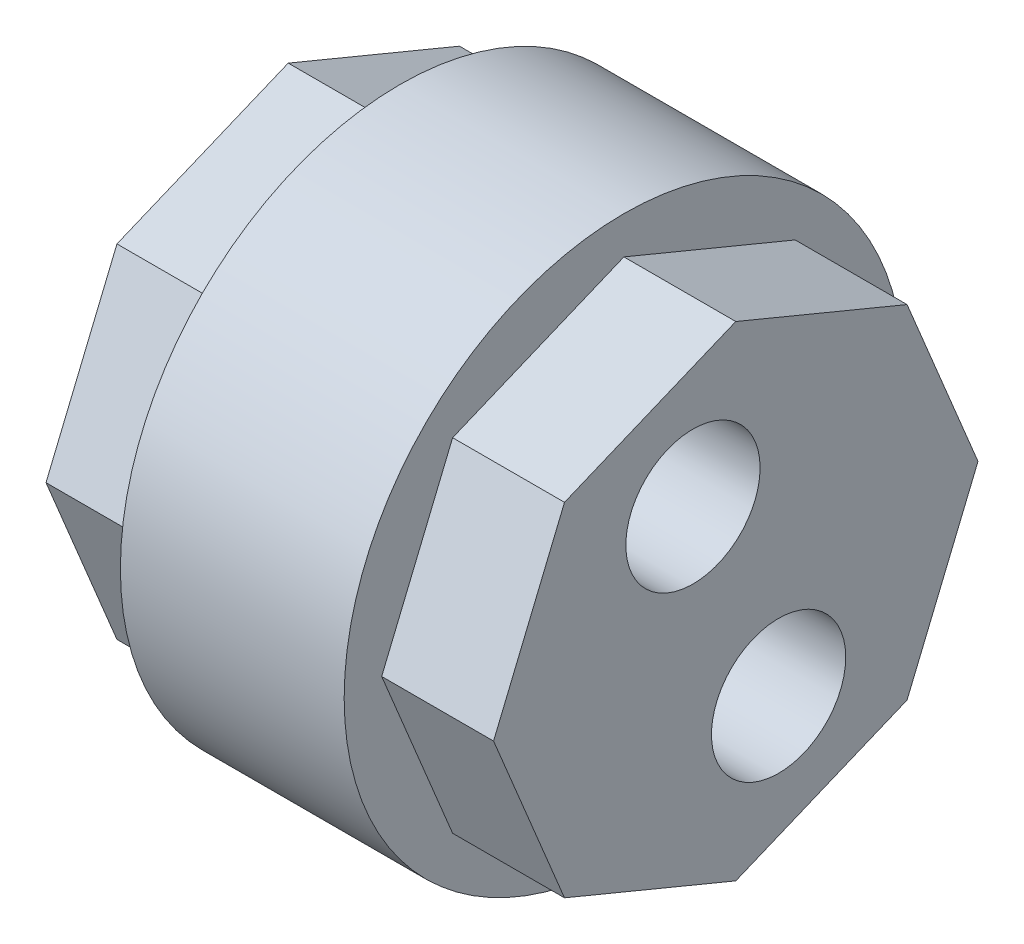
from build123d import *

# Parameters (mm, degrees)
SKETCH2_R                = 12.5
BOSS_EXTRUDE1_DEPTH      = 10
BOSS_EXTRUDE3_DEPTH      = 5
BOSS_EXTRUDE3_DEPTH_BACK = 15
SKETCH4_R                = 1
CUT_EXTRUDE1_DEPTH       = 20
SKETCH5_R                = 3
CUT_EXTRUDE2_DEPTH       = 5
CUT_EXTRUDE3_START       = -10
SKETCH6_R                = 3
CUT_EXTRUDE3_DEPTH       = 10


with BuildPart() as part:
    # Sketch2 → Boss-Extrude1 (new body)
    with BuildSketch(Plane(origin=(0, 0, 0), x_dir=(0, 0, -1), z_dir=(1, 0, 0))):
        Circle(SKETCH2_R)
    extrude(amount=BOSS_EXTRUDE1_DEPTH)

    # Sketch3 → Boss-Extrude3 (add, two sides: drawn at the far end of the back side and taken through both)
    with BuildSketch(Plane.ZY.offset(-BOSS_EXTRUDE3_DEPTH_BACK)):
        Polygon((10.823922003, 0), (7.653668647, 7.653668647), (0, 10.823922003), (-7.653668647, 7.653668647), (-10.823922003, 0), (-7.653668647, -7.653668647), (0, -10.823922003), (7.653668647, -7.653668647), align=None)
    extrude(amount=BOSS_EXTRUDE3_DEPTH + BOSS_EXTRUDE3_DEPTH_BACK)

    # Sketch4 → Cut-Extrude1 (cut)
    with BuildSketch(Plane.ZY.offset(5)):
        with Locations((1.913417162, 4.619397663)):
            Circle(SKETCH4_R)
        with Locations((-1.913417162, -4.619397663)):
            Circle(SKETCH4_R)
    extrude(amount=-CUT_EXTRUDE1_DEPTH, mode=Mode.SUBTRACT)

    # Sketch5 → Cut-Extrude2 (cut)
    with BuildSketch(Plane.ZY.offset(5)):
        with Locations((-1.913417162, -4.619397663)):
            Circle(SKETCH5_R)
        with Locations((1.913417162, 4.619397663)):
            Circle(SKETCH5_R)
    extrude(amount=-CUT_EXTRUDE2_DEPTH, mode=Mode.SUBTRACT)

    # Sketch6 → Cut-Extrude3 (cut)
    with BuildSketch(Plane(origin=(15, 0, 0), x_dir=(0, 0, -1), z_dir=(1, 0, 0)).offset(CUT_EXTRUDE3_START)):
        with Locations(Location((1.913417162, -4.619397663, 0), (0, 0, 180))):
            Circle(SKETCH6_R)
        with Locations(Location((-1.913417162, 4.619397663, 0), (0, 0, 180))):
            Circle(SKETCH6_R)
    extrude(amount=CUT_EXTRUDE3_DEPTH, mode=Mode.SUBTRACT)


solid = part.part
